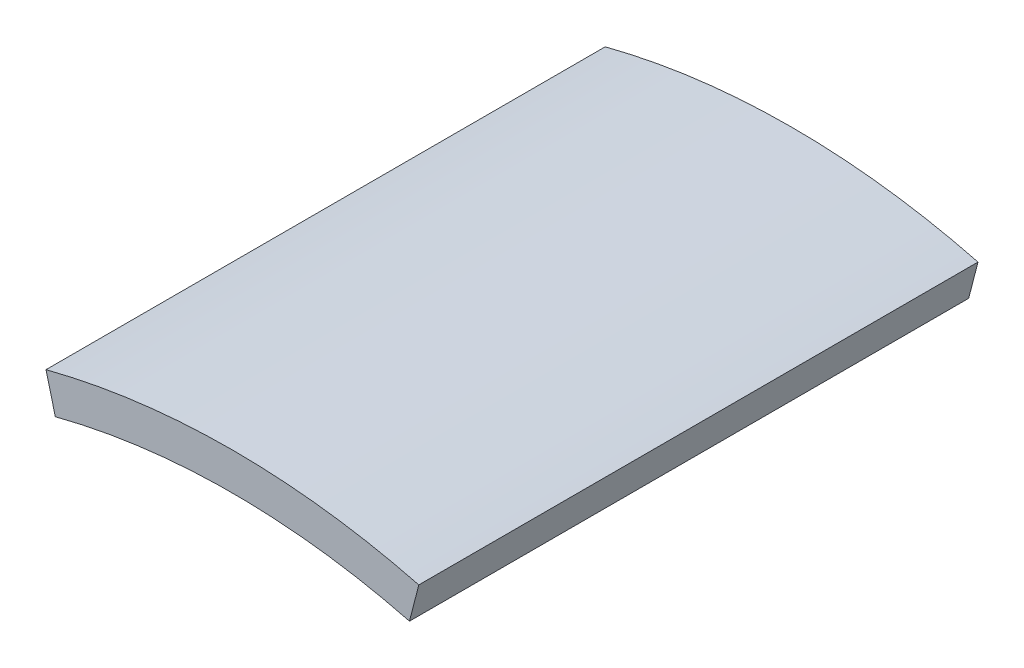
from build123d import *

# Parameters (mm, degrees)
BOSS_EXTRU_1_DEPTH = 30


with BuildPart() as part:
    # Esquisse1 → Boss.-Extru.1 (new body)
    with BuildSketch(Plane.XY):
        with BuildLine():
            Line((0, 0), (0.5, -1.936491673))
            ThreePointArc((0.5, -1.936491673), (10, -0.729833462), (19.5, -1.936491673))
            Line((19.5, -1.936491673), (20, 0))
            ThreePointArc((20, 0), (10, 1.270166538), (0, 0))
        make_face()
    extrude(amount=BOSS_EXTRU_1_DEPTH)


solid = part.part
